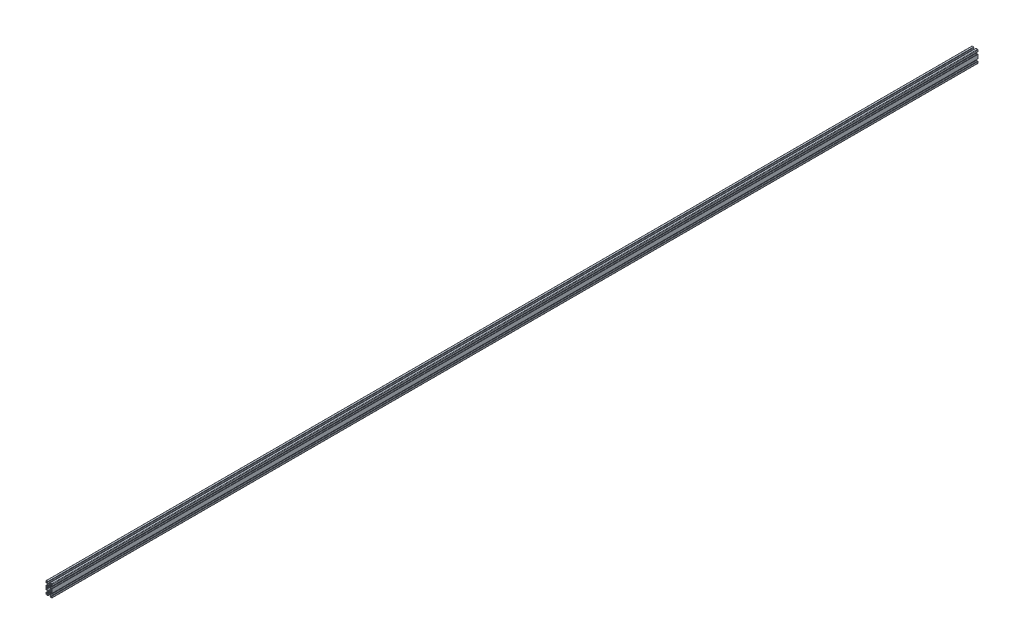
from build123d import *

# Parameters (mm, degrees)
EXTRUDE1_DEPTH = 3000


with BuildPart() as part:
    # Sketch1 → Extrude1 (new body)
    with BuildSketch(Plane.XY):
        with BuildLine():
            Line((10, -3.749999824), (10, -8.500000461))
            ThreePointArc((10, -8.500000461), (9.560660307, -9.560660307), (8.500000461, -10))
            Line((8.500000461, -10), (3.699999971, -10))
            ThreePointArc((3.699999971, -10), (3.558578595, -9.941421336), (3.499999971, -9.799999942))
            Line((3.499999971, -9.799999942), (3.5, -9.699999942))
            ThreePointArc((3.5, -9.699999942), (3.441421377, -9.558578549), (3.3, -9.499999885))
            Line((3.3, -9.499999885), (3.2, -9.499999885))
            ThreePointArc((3.2, -9.499999885), (3.058578644, -9.441421241), (3, -9.299999885))
            Line((3, -9.299999885), (3, -9.000001846))
            ThreePointArc((3, -9.000001846), (3.146446609, -8.646448455), (3.5, -8.500001846))
            Line((3.5, -8.500001846), (5.499999866, -8.500001846))
            ThreePointArc((5.499999866, -8.500001846), (5.853553351, -8.353555197), (6, -8.000001712))
            Line((6, -8.000001712), (6, -7.267766328))
            ThreePointArc((6, -7.267766328), (5.961939756, -7.076424587), (5.853553353, -6.914212899))
            Line((5.853553353, -6.914212899), (3.585786596, -4.646446628))
            ThreePointArc((3.585786596, -4.646446628), (3.423574935, -4.53806028), (3.232233243, -4.500000057))
            Line((3.232233243, -4.500000057), (0.953593447, -4.500000057))
            ThreePointArc((0.953593447, -4.500000057), (0.901829637, -4.493185222), (0.853593445, -4.473205136))
            Line((0.853593445, -4.473205136), (0.100000013, -4.038117753))
            ThreePointArc((0.100000013, -4.038117753), (0, -4.011322829), (-0.100000013, -4.038117753))
            Line((-0.100000013, -4.038117753), (-0.853593445, -4.473205136))
            ThreePointArc((-0.853593445, -4.473205136), (-0.901829637, -4.493185222), (-0.953593447, -4.500000057))
            Line((-0.953593447, -4.500000057), (-3.232233243, -4.500000057))
            ThreePointArc((-3.232233243, -4.500000057), (-3.423574935, -4.53806028), (-3.585786596, -4.646446628))
            Line((-3.585786596, -4.646446628), (-5.853553353, -6.914212899))
            ThreePointArc((-5.853553353, -6.914212899), (-5.961939756, -7.076424587), (-6, -7.267766328))
            Line((-6, -7.267766328), (-6, -8.000000007))
            ThreePointArc((-6, -8.000000007), (-5.85355339, -8.353553398), (-5.499999998, -8.500000007))
            Line((-5.499999998, -8.500000007), (-3.500000002, -8.5))
            ThreePointArc((-3.500000002, -8.5), (-3.14644661, -8.646446609), (-3, -9))
            Line((-3, -9), (-3, -9.299998039))
            ThreePointArc((-3, -9.299998039), (-3.058578644, -9.441419395), (-3.2, -9.499998039))
            Line((-3.2, -9.499998039), (-3.3, -9.499998039))
            ThreePointArc((-3.3, -9.499998039), (-3.441421703, -9.558577029), (-3.5, -9.699999019))
            Line((-3.5, -9.699999019), (-3.49999951, -9.799999019))
            ThreePointArc((-3.49999951, -9.799999019), (-3.558577807, -9.94142101), (-3.69999951, -10))
            Line((-3.69999951, -10), (-8.5, -10))
            ThreePointArc((-8.5, -10), (-9.560660172, -9.560660172), (-10, -8.5))
            Line((-10, -8.5), (-10, -3.749999824))
            ThreePointArc((-10, -3.749999824), (-9.941421232, -3.608578344), (-9.799999649, -3.549999824))
            Line((-9.799999649, -3.549999824), (-9.699999649, -3.55))
            ThreePointArc((-9.699999649, -3.55), (-9.558578066, -3.49142148), (-9.499999298, -3.35))
            Line((-9.499999298, -3.35), (-9.499999298, -3.25))
            ThreePointArc((-9.499999298, -3.25), (-9.441420654, -3.108578644), (-9.299999298, -3.05))
            Line((-9.299999298, -3.05), (-8.999999788, -3.05))
            ThreePointArc((-8.999999788, -3.05), (-8.646446398, -3.196446609), (-8.499999788, -3.55))
            Line((-8.499999788, -3.55), (-8.499999788, -5.50000039))
            ThreePointArc((-8.499999788, -5.50000039), (-8.35355314, -5.853553875), (-7.999999654, -6.000000524))
            Line((-7.999999654, -6.000000524), (-7.267766643, -6.000000524))
            ThreePointArc((-7.267766643, -6.000000524), (-7.076424734, -5.96194021), (-6.914212957, -5.853553619))
            Line((-6.914212957, -5.853553619), (-4.646446283, -3.585783155))
            ThreePointArc((-4.646446283, -3.585783155), (-4.538060123, -3.423571583), (-4.499999969, -3.23223006))
            Line((-4.499999969, -3.23223006), (-4.499999969, -0.953590264))
            ThreePointArc((-4.499999969, -0.953590264), (-4.493185135, -0.901826456), (-4.473205051, -0.853590266))
            Line((-4.473205051, -0.853590266), (-4.038119483, -0.099999935))
            ThreePointArc((-4.038119483, -0.099999935), (-4.011324562, 7.7e-08), (-4.038119486, 0.100000089))
            Line((-4.038119486, 0.100000089), (-4.473205047, 0.853590344))
            ThreePointArc((-4.473205047, 0.853590344), (-4.493185134, 0.901826537), (-4.499999969, 0.953590348))
            Line((-4.499999969, 0.953590348), (-4.499999969, 3.232230144))
            ThreePointArc((-4.499999969, 3.232230144), (-4.538060128, 3.423571679), (-4.6464463, 3.585783257))
            Line((-4.6464463, 3.585783257), (-6.914212063, 5.853552589))
            ThreePointArc((-6.914212063, 5.853552589), (-7.076423834, 5.961939167), (-7.267765732, 5.999999476))
            Line((-7.267765732, 5.999999476), (-8.000000569, 5.999999476))
            ThreePointArc((-8.000000569, 5.999999476), (-8.35355396, 5.853552867), (-8.500000569, 5.499999476))
            Line((-8.500000569, 5.499999476), (-8.500000569, 3.45))
            ThreePointArc((-8.500000569, 3.45), (-8.646447179, 3.096446609), (-9.000000569, 2.95))
            Line((-9.000000569, 2.95), (-9.300000079, 2.95))
            ThreePointArc((-9.300000079, 2.95), (-9.441421491, 3.008578699), (-9.500000079, 3.150000158))
            Line((-9.500000079, 3.150000158), (-9.5, 3.250000158))
            ThreePointArc((-9.5, 3.250000158), (-9.558578588, 3.391421616), (-9.7, 3.450000315))
            Line((-9.7, 3.450000315), (-9.8, 3.450000315))
            ThreePointArc((-9.8, 3.450000315), (-9.941421356, 3.508578959), (-10, 3.650000315))
            Line((-10, 3.650000315), (-10, 9.999999757))
            Line((-10, 9.999999757), (-10, 16.3))
            ThreePointArc((-10, 16.3), (-9.941421356, 16.441421356), (-9.8, 16.5))
            Line((-9.8, 16.5), (-9.7, 16.5))
            ThreePointArc((-9.7, 16.5), (-9.558578644, 16.558578644), (-9.5, 16.7))
            Line((-9.5, 16.7), (-9.5, 16.8))
            ThreePointArc((-9.5, 16.8), (-9.441421356, 16.941421356), (-9.3, 17))
            Line((-9.3, 17), (-9.00000049, 17))
            ThreePointArc((-9.00000049, 17), (-8.6464471, 16.853553391), (-8.50000049, 16.5))
            Line((-8.50000049, 16.5), (-8.50000049, 14.55))
            ThreePointArc((-8.50000049, 14.55), (-8.353553881, 14.196446609), (-8.00000049, 14.05))
            Line((-8.00000049, 14.05), (-7.217766334, 14.05))
            ThreePointArc((-7.217766334, 14.05), (-7.026424436, 14.088060309), (-6.864212665, 14.196446888))
            Line((-6.864212665, 14.196446888), (-4.6464463, 16.414216743))
            ThreePointArc((-4.6464463, 16.414216743), (-4.538060128, 16.576428321), (-4.499999969, 16.767769856))
            Line((-4.499999969, 16.767769856), (-4.499999969, 19.046409652))
            ThreePointArc((-4.499999969, 19.046409652), (-4.493185134, 19.098173463), (-4.473205047, 19.146409656))
            Line((-4.473205047, 19.146409656), (-4.038119486, 19.899999911))
            ThreePointArc((-4.038119486, 19.899999911), (-4.011324562, 19.999999923), (-4.038119483, 20.099999935))
            Line((-4.038119483, 20.099999935), (-4.473205051, 20.853590266))
            ThreePointArc((-4.473205051, 20.853590266), (-4.493185135, 20.901826456), (-4.499999969, 20.953590264))
            Line((-4.499999969, 20.953590264), (-4.499999969, 23.23223006))
            ThreePointArc((-4.499999969, 23.23223006), (-4.538060123, 23.423571583), (-4.646446283, 23.585783155))
            Line((-4.646446283, 23.585783155), (-6.96421235, 25.903553095))
            ThreePointArc((-6.96421235, 25.903553095), (-7.126424126, 26.011939686), (-7.317766036, 26.05))
            Line((-7.317766036, 26.05), (-7.999999654, 26.05))
            ThreePointArc((-7.999999654, 26.05), (-8.35355314, 25.903553351), (-8.499999788, 25.549999866))
            Line((-8.499999788, 25.549999866), (-8.499999788, 23.5))
            ThreePointArc((-8.499999788, 23.5), (-8.646446398, 23.146446609), (-8.999999788, 23))
            Line((-8.999999788, 23), (-9.299999298, 23))
            ThreePointArc((-9.299999298, 23), (-9.441420654, 23.058578644), (-9.499999298, 23.2))
            Line((-9.499999298, 23.2), (-9.499999298, 23.3))
            ThreePointArc((-9.499999298, 23.3), (-9.558578066, 23.44142148), (-9.699999649, 23.5))
            Line((-9.699999649, 23.5), (-9.799999649, 23.499999824))
            ThreePointArc((-9.799999649, 23.499999824), (-9.941421232, 23.558578344), (-10, 23.699999824))
            Line((-10, 23.699999824), (-10, 28.5))
            ThreePointArc((-10, 28.5), (-9.560660172, 29.560660172), (-8.5, 30))
            Line((-8.5, 30), (-3.699999511, 30))
            ThreePointArc((-3.699999511, 30), (-3.55857781, 29.941421011), (-3.499999511, 29.799999023))
            Line((-3.499999511, 29.799999023), (-3.5, 29.699999023))
            ThreePointArc((-3.5, 29.699999023), (-3.441421702, 29.558577035), (-3.3, 29.499998046))
            Line((-3.3, 29.499998046), (-3.2, 29.499998046))
            ThreePointArc((-3.2, 29.499998046), (-3.058578644, 29.441419402), (-3, 29.299998046))
            Line((-3, 29.299998046), (-3, 29.000000007))
            ThreePointArc((-3, 29.000000007), (-3.146446609, 28.646446616), (-3.5, 28.500000007))
            Line((-3.5, 28.500000007), (-5.5, 28.500000007))
            ThreePointArc((-5.5, 28.500000007), (-5.853553391, 28.353553397), (-6, 28.000000007))
            Line((-6, 28.000000007), (-6, 27.267766328))
            ThreePointArc((-6, 27.267766328), (-5.961940442, 27.076426242), (-5.853555886, 26.914215433))
            Line((-5.853555886, 26.914215433), (-3.585869751, 24.646497282))
            ThreePointArc((-3.585869751, 24.646497282), (-3.423657211, 24.538109086), (-3.232313865, 24.500048177))
            Line((-3.232313865, 24.500048177), (-0.953674069, 24.500048177))
            ThreePointArc((-0.953674069, 24.500048177), (-0.901910257, 24.493233342), (-0.853674064, 24.473253255))
            Line((-0.853674064, 24.473253255), (-0.100000047, 24.038119334))
            ThreePointArc((-0.100000047, 24.038119334), (-3.5e-08, 24.011324409), (0.099999978, 24.03811933))
            Line((0.099999978, 24.03811933), (0.853674071, 24.473253259))
            ThreePointArc((0.853674071, 24.473253259), (0.901910261, 24.493233342), (0.953674069, 24.500048177))
            Line((0.953674069, 24.500048177), (3.232313865, 24.500048177))
            ThreePointArc((3.232313865, 24.500048177), (3.423657211, 24.538109086), (3.585869751, 24.646497282))
            Line((3.585869751, 24.646497282), (5.853555886, 26.914215433))
            ThreePointArc((5.853555886, 26.914215433), (5.961940442, 27.076426242), (6, 27.267766328))
            Line((6, 27.267766328), (6, 28.000001712))
            ThreePointArc((6, 28.000001712), (5.853553351, 28.353555197), (5.499999866, 28.500001846))
            Line((5.499999866, 28.500001846), (3.5, 28.500001846))
            ThreePointArc((3.5, 28.500001846), (3.146446609, 28.646448455), (3, 29.000001846))
            Line((3, 29.000001846), (3, 29.299999885))
            ThreePointArc((3, 29.299999885), (3.058578562, 29.441421159), (3.199999769, 29.499999885))
            Line((3.199999769, 29.499999885), (3.299999769, 29.5))
            ThreePointArc((3.299999769, 29.5), (3.441420976, 29.558578725), (3.499999539, 29.7))
            Line((3.499999539, 29.7), (3.499999539, 29.8))
            ThreePointArc((3.499999539, 29.8), (3.558578182, 29.941421356), (3.699999539, 30))
            Line((3.699999539, 30), (8.500000027, 30))
            ThreePointArc((8.500000027, 30), (9.56066018, 29.56066018), (10, 28.500000027))
            Line((10, 28.500000027), (10, 23.699999824))
            ThreePointArc((10, 23.699999824), (9.941421232, 23.558578344), (9.799999649, 23.499999824))
            Line((9.799999649, 23.499999824), (9.699999649, 23.5))
            ThreePointArc((9.699999649, 23.5), (9.558578066, 23.44142148), (9.499999298, 23.3))
            Line((9.499999298, 23.3), (9.499999298, 23.2))
            ThreePointArc((9.499999298, 23.2), (9.441420654, 23.058578644), (9.299999298, 23))
            Line((9.299999298, 23), (8.999999788, 23))
            ThreePointArc((8.999999788, 23), (8.646446398, 23.146446609), (8.499999788, 23.5))
            Line((8.499999788, 23.5), (8.499999788, 25.499999261))
            ThreePointArc((8.499999788, 25.499999261), (8.353553179, 25.853552652), (7.999999788, 25.999999261))
            Line((7.999999788, 25.999999261), (7.267765381, 25.999999261))
            ThreePointArc((7.267765381, 25.999999261), (7.076423471, 25.961938948), (6.914211695, 25.853552357))
            Line((6.914211695, 25.853552357), (4.646446283, 23.585783155))
            ThreePointArc((4.646446283, 23.585783155), (4.538060123, 23.423571583), (4.499999969, 23.23223006))
            Line((4.499999969, 23.23223006), (4.499999969, 20.953590264))
            ThreePointArc((4.499999969, 20.953590264), (4.493185135, 20.901826456), (4.473205051, 20.853590266))
            Line((4.473205051, 20.853590266), (4.038119525, 20.100000009))
            ThreePointArc((4.038119525, 20.100000009), (4.011324604, 20.000000005), (4.03811952, 19.899999999))
            Line((4.03811952, 19.899999999), (4.473205056, 19.146409641))
            ThreePointArc((4.473205056, 19.146409641), (4.493185136, 19.098173455), (4.499999969, 19.046409652))
            Line((4.499999969, 19.046409652), (4.499999969, 16.767769856))
            ThreePointArc((4.499999969, 16.767769856), (4.538060128, 16.576428321), (4.6464463, 16.414216743))
            Line((4.6464463, 16.414216743), (6.914213325, 14.146446149))
            ThreePointArc((6.914213325, 14.146446149), (7.076425096, 14.03805957), (7.267766994, 13.999999261))
            Line((7.267766994, 13.999999261), (7.999999654, 13.999999261))
            ThreePointArc((7.999999654, 13.999999261), (8.35355314, 14.14644591), (8.499999788, 14.499999395))
            Line((8.499999788, 14.499999395), (8.499999788, 16.5))
            ThreePointArc((8.499999788, 16.5), (8.646446398, 16.853553391), (8.999999788, 17))
            Line((8.999999788, 17), (9.299999298, 17))
            ThreePointArc((9.299999298, 17), (9.441420654, 16.941421356), (9.499999298, 16.8))
            Line((9.499999298, 16.8), (9.499999298, 16.7))
            ThreePointArc((9.499999298, 16.7), (9.558578066, 16.55857852), (9.699999649, 16.5))
            Line((9.699999649, 16.5), (9.799999649, 16.500000176))
            ThreePointArc((9.799999649, 16.500000176), (9.941421232, 16.441421656), (10, 16.300000176))
            Line((10, 16.300000176), (10, 10))
            Line((10, 10), (10, 3.650000315))
            ThreePointArc((10, 3.650000315), (9.941421356, 3.508578959), (9.8, 3.450000315))
            Line((9.8, 3.450000315), (9.7, 3.450000315))
            ThreePointArc((9.7, 3.450000315), (9.558578588, 3.391421616), (9.5, 3.250000158))
            Line((9.5, 3.250000158), (9.500000079, 3.150000158))
            ThreePointArc((9.500000079, 3.150000158), (9.441421491, 3.0085787), (9.300000079, 2.95))
            Line((9.300000079, 2.95), (9.000000569, 2.95))
            ThreePointArc((9.000000569, 2.95), (8.646447179, 3.096446609), (8.500000569, 3.45))
            Line((8.500000569, 3.45), (8.500000569, 5.499999342))
            ThreePointArc((8.500000569, 5.499999342), (8.353553921, 5.853552828), (8.000000435, 5.999999476))
            Line((8.000000435, 5.999999476), (7.267765732, 5.999999476))
            ThreePointArc((7.267765732, 5.999999476), (7.076423834, 5.961939167), (6.914212063, 5.853552589))
            Line((6.914212063, 5.853552589), (4.6464463, 3.585783257))
            ThreePointArc((4.6464463, 3.585783257), (4.538060128, 3.423571679), (4.499999969, 3.232230144))
            Line((4.499999969, 3.232230144), (4.499999969, 0.953590348))
            ThreePointArc((4.499999969, 0.953590348), (4.493185136, 0.901826545), (4.473205056, 0.853590359))
            Line((4.473205056, 0.853590359), (4.03811952, 0.100000001))
            ThreePointArc((4.03811952, 0.100000001), (4.011324604, -5e-09), (4.038119525, -0.100000009))
            Line((4.038119525, -0.100000009), (4.473205051, -0.853590266))
            ThreePointArc((4.473205051, -0.853590266), (4.493185135, -0.901826456), (4.499999969, -0.953590264))
            Line((4.499999969, -0.953590264), (4.499999969, -3.23223006))
            ThreePointArc((4.499999969, -3.23223006), (4.538060123, -3.423571583), (4.646446283, -3.585783155))
            Line((4.646446283, -3.585783155), (6.914212957, -5.853553619))
            ThreePointArc((6.914212957, -5.853553619), (7.076424734, -5.96194021), (7.267766643, -6.000000524))
            Line((7.267766643, -6.000000524), (7.999999788, -6.000000524))
            ThreePointArc((7.999999788, -6.000000524), (8.353553179, -5.853553914), (8.499999788, -5.500000524))
            Line((8.499999788, -5.500000524), (8.499999788, -3.55))
            ThreePointArc((8.499999788, -3.55), (8.646446398, -3.196446609), (8.999999788, -3.05))
            Line((8.999999788, -3.05), (9.299999298, -3.05))
            ThreePointArc((9.299999298, -3.05), (9.441420654, -3.108578644), (9.499999298, -3.25))
            Line((9.499999298, -3.25), (9.499999298, -3.35))
            ThreePointArc((9.499999298, -3.35), (9.558578066, -3.49142148), (9.699999649, -3.55))
            Line((9.699999649, -3.55), (9.799999649, -3.549999824))
            ThreePointArc((9.799999649, -3.549999824), (9.941421232, -3.608578344), (10, -3.749999824))
        make_face()
        with BuildLine():
            Line((2.445295362, 18.741814564), (2.947714945, 18.112944992))
            ThreePointArc((2.947714945, 18.112944992), (2.474873674, 17.525126206), (1.887054865, 17.052284963))
            Line((1.887054865, 17.052284963), (1.258185317, 17.554704577))
            ThreePointArc((1.258185317, 17.554704577), (-6.7e-08, 17.25), (-1.258185436, 17.554704638))
            Line((-1.258185436, 17.554704638), (-1.887055008, 17.052285055))
            ThreePointArc((-1.887055008, 17.052285055), (-2.474873794, 17.525126326), (-2.947715037, 18.112945135))
            Line((-2.947715037, 18.112945135), (-2.445295423, 18.741814683))
            ThreePointArc((-2.445295423, 18.741814683), (-2.75, 20.000000067), (-2.445295362, 21.258185436))
            Line((-2.445295362, 21.258185436), (-2.947714945, 21.887055008))
            ThreePointArc((-2.947714945, 21.887055008), (-2.474873674, 22.474873794), (-1.887054865, 22.947715037))
            Line((-1.887054865, 22.947715037), (-1.258185317, 22.445295423))
            ThreePointArc((-1.258185317, 22.445295423), (6.7e-08, 22.75), (1.258185436, 22.445295362))
            Line((1.258185436, 22.445295362), (1.887055008, 22.947714945))
            ThreePointArc((1.887055008, 22.947714945), (2.474873794, 22.474873674), (2.947715037, 21.887054865))
            Line((2.947715037, 21.887054865), (2.445295423, 21.258185317))
            ThreePointArc((2.445295423, 21.258185317), (2.75, 19.999999933), (2.445295362, 18.741814564))
        make_face(mode=Mode.SUBTRACT)
        with BuildLine():
            Line((3.232248767, 15.499989219), (0.953608971, 15.499989219))
            ThreePointArc((0.953608971, 15.499989219), (0.90184516, 15.506804055), (0.853608967, 15.526784141))
            Line((0.853608967, 15.526784141), (0.100000047, 15.961880478))
            ThreePointArc((0.100000047, 15.961880478), (3.5e-08, 15.988675403), (-0.099999978, 15.961880482))
            Line((-0.099999978, 15.961880482), (-0.853608973, 15.526784137))
            ThreePointArc((-0.853608973, 15.526784137), (-0.901845163, 15.506804054), (-0.953608971, 15.499989219))
            Line((-0.953608971, 15.499989219), (-3.232248767, 15.499989219))
            ThreePointArc((-3.232248767, 15.499989219), (-3.42359066, 15.461928912), (-3.585802428, 15.35354234))
            Line((-3.585802428, 15.35354234), (-6.292893753, 12.646446879))
            ThreePointArc((-6.292893753, 12.646446879), (-6.455105521, 12.538060307), (-6.646447414, 12.5))
            Line((-6.646447414, 12.5), (-7.999999788, 12.5))
            ThreePointArc((-7.999999788, 12.5), (-8.353553179, 12.353553391), (-8.499999788, 12))
            Line((-8.499999788, 12), (-8.499999788, 8))
            ThreePointArc((-8.499999788, 8), (-8.353553179, 7.646446609), (-7.999999788, 7.5))
            Line((-7.999999788, 7.5), (-6.646447414, 7.5))
            ThreePointArc((-6.646447414, 7.5), (-6.455102332, 7.461938372), (-6.292888871, 7.353548238))
            Line((-6.292888871, 7.353548238), (-3.585984195, 4.646564667))
            ThreePointArc((-3.585984195, 4.646564667), (-3.423770734, 4.538174533), (-3.232425652, 4.500112905))
            Line((-3.232425652, 4.500112905), (-0.953785856, 4.500112905))
            ThreePointArc((-0.953785856, 4.500112905), (-0.902022048, 4.493298071), (-0.853785858, 4.473317987))
            Line((-0.853785858, 4.473317987), (-0.099999978, 4.038119518))
            ThreePointArc((-0.099999978, 4.038119518), (3.5e-08, 4.011324597), (0.100000047, 4.038119522))
            Line((0.100000047, 4.038119522), (0.853785852, 4.473317984))
            ThreePointArc((0.853785852, 4.473317984), (0.902022045, 4.49329807), (0.953785856, 4.500112905))
            Line((0.953785856, 4.500112905), (3.232425652, 4.500112905))
            ThreePointArc((3.232425652, 4.500112905), (3.423770734, 4.538174533), (3.585984195, 4.646564667))
            Line((3.585984195, 4.646564667), (6.292888591, 7.353547959))
            ThreePointArc((6.292888591, 7.353547959), (6.455102052, 7.461938093), (6.646447134, 7.49999972))
            Line((6.646447134, 7.49999972), (7.999999788, 7.49999972))
            ThreePointArc((7.999999788, 7.49999972), (8.353553179, 7.64644633), (8.499999788, 7.99999972))
            Line((8.499999788, 7.99999972), (8.499999788, 12.000000281))
            ThreePointArc((8.499999788, 12.000000281), (8.353553179, 12.353553672), (7.999999788, 12.500000281))
            Line((7.999999788, 12.500000281), (6.646447132, 12.500000281))
            ThreePointArc((6.646447132, 12.500000281), (6.45510524, 12.538060588), (6.292893472, 12.646447161))
            Line((6.292893472, 12.646447161), (3.585802428, 15.35354234))
            ThreePointArc((3.585802428, 15.35354234), (3.42359066, 15.461928912), (3.232248767, 15.499989219))
        make_face(mode=Mode.SUBTRACT)
        with BuildLine():
            Line((1.258185436, -2.445295362), (1.887055008, -2.947714945))
            ThreePointArc((1.887055008, -2.947714945), (2.474873794, -2.474873674), (2.947715037, -1.887054865))
            Line((2.947715037, -1.887054865), (2.445295423, -1.258185317))
            ThreePointArc((2.445295423, -1.258185317), (2.75, 6.7e-08), (2.445295362, 1.258185436))
            Line((2.445295362, 1.258185436), (2.947714945, 1.887055008))
            ThreePointArc((2.947714945, 1.887055008), (2.474873674, 2.474873794), (1.887054865, 2.947715037))
            Line((1.887054865, 2.947715037), (1.258185317, 2.445295423))
            ThreePointArc((1.258185317, 2.445295423), (-6.7e-08, 2.75), (-1.258185436, 2.445295362))
            Line((-1.258185436, 2.445295362), (-1.887055008, 2.947714945))
            ThreePointArc((-1.887055008, 2.947714945), (-2.474873794, 2.474873674), (-2.947715037, 1.887054865))
            Line((-2.947715037, 1.887054865), (-2.445295423, 1.258185317))
            ThreePointArc((-2.445295423, 1.258185317), (-2.75, -6.7e-08), (-2.445295362, -1.258185436))
            Line((-2.445295362, -1.258185436), (-2.947714945, -1.887055008))
            ThreePointArc((-2.947714945, -1.887055008), (-2.474873674, -2.474873794), (-1.887054865, -2.947715037))
            Line((-1.887054865, -2.947715037), (-1.258185317, -2.445295423))
            ThreePointArc((-1.258185317, -2.445295423), (6.7e-08, -2.75), (1.258185436, -2.445295362))
        make_face(mode=Mode.SUBTRACT)
    extrude(amount=EXTRUDE1_DEPTH)


solid = part.part
